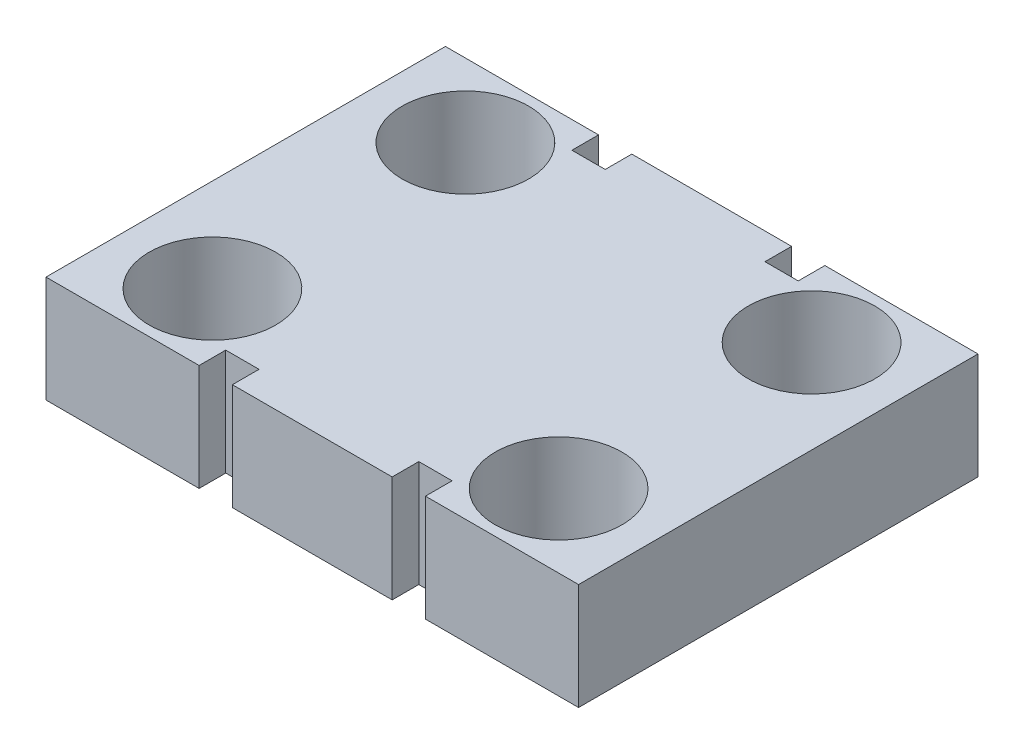
from build123d import *

# Parameters (mm, degrees)
SKETCH1_W           = 40
SKETCH1_H           = 30
BOSS_EXTRUDE1_DEPTH = 8
SKETCH2_R           = 4.75
CUT_EXTRUDE1_DEPTH  = 7
SKETCH3_R           = 3.15
CUT_EXTRUDE2_DEPTH  = 5
SKETCH4_W           = 2.5
SKETCH4_H           = 2
CUT_EXTRUDE3_DEPTH  = 15


with BuildPart() as part:
    # Sketch1 → Boss-Extrude1 (new body)
    with BuildSketch(Plane(origin=(0, 0, 0), x_dir=(1, 0, 0), z_dir=(0, 1, 0))):
        with Locations((-20, 15)):
            Rectangle(SKETCH1_W, SKETCH1_H)
    extrude(amount=BOSS_EXTRUDE1_DEPTH)

    # Sketch2 → Cut-Extrude1 (cut)
    with BuildSketch(Plane(origin=(0, 8, 0), x_dir=(1, 0, 0), z_dir=(0, 1, 0))):
        with Locations(Location((-33, 24.5, 0), (0, 0, 270))):
            Circle(SKETCH2_R)
        with Locations(Location((-33, 5.5, 0), (0, 0, 90))):
            Circle(SKETCH2_R)
        with Locations(Location((-7, 5.5, 0), (0, 0, 270))):
            Circle(SKETCH2_R)
        with Locations(Location((-7, 24.5, 0), (0, 0, 90))):
            Circle(SKETCH2_R)
    extrude(amount=-CUT_EXTRUDE1_DEPTH, mode=Mode.SUBTRACT)

    # Sketch3 → Cut-Extrude2 (cut)
    with BuildSketch(Plane.XZ):
        with Locations(Location((-20, -15, 0), (0, 0, 270))):
            Circle(SKETCH3_R)
    extrude(amount=-CUT_EXTRUDE2_DEPTH, mode=Mode.SUBTRACT)

    # Sketch4 → Cut-Extrude3 (cut)
    with BuildSketch(Plane.XZ):
        with Locations((-12.75, -1)):
            Rectangle(SKETCH4_W, SKETCH4_H)
        with Locations((-27.25, -1)):
            Rectangle(SKETCH4_W, SKETCH4_H)
        with Locations((-12.75, -29)):
            Rectangle(SKETCH4_W, SKETCH4_H)
        with Locations((-27.25, -29)):
            Rectangle(SKETCH4_W, SKETCH4_H)
    extrude(amount=-CUT_EXTRUDE3_DEPTH, mode=Mode.SUBTRACT)


solid = part.part
